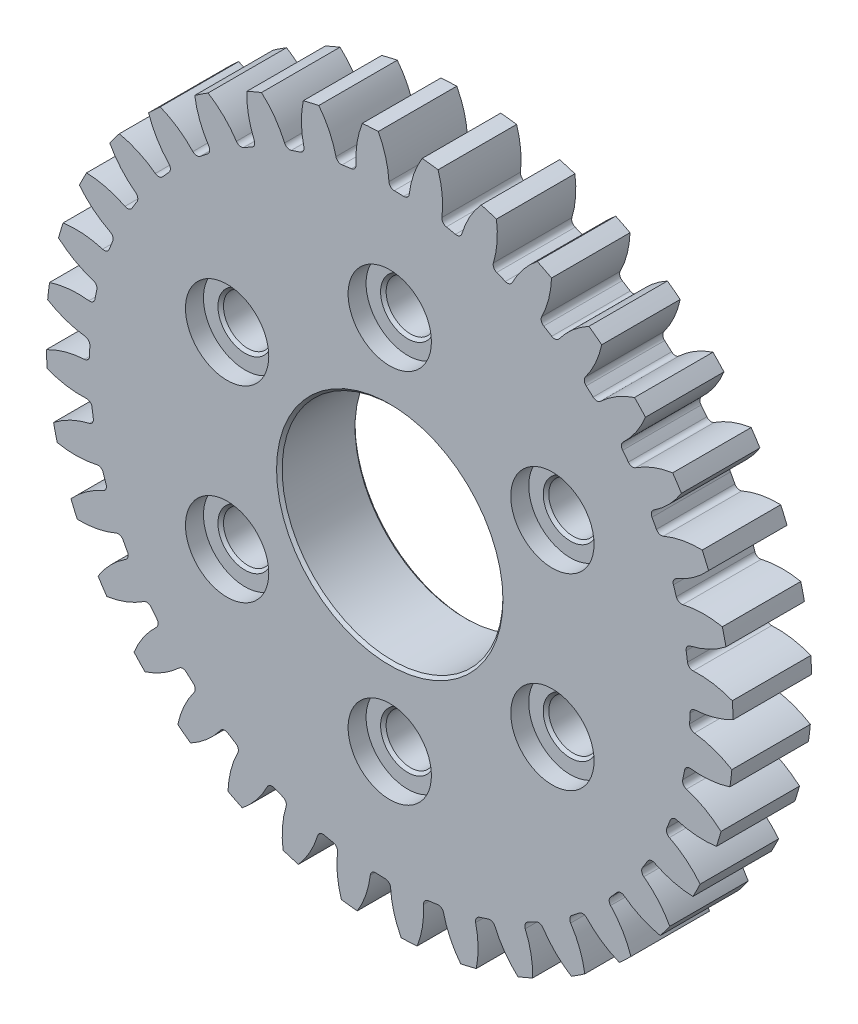
from build123d import *

# Parameters (mm, degrees)
SKETCH1_R                = 24.69999886
SKETCH1_R_2              = 23.39999892
SKETCH1_R_3              = 21.579999004
BOSS_EXTRUDE1_DEPTH      = 2.821
SKETCH8_R                = 7.9375
SKETCH8_R_2              = 1.7526
CUT_EXTRUDE1_DEPTH       = 36.383782321
CUT_EXTRUDE2_DEPTH       = 36.383782321
FILLET3_R                = 0.389999982
CIRPATTERN3_COUNT        = 36
FILLET3_OF_CIRPATTERN3_R = 0.389999982
SKETCH9_R                = 2.994
CUT_EXTRUDE3_DEPTH       = 1.292000064
CHAMFER1_SIZE            = 0.2


with BuildPart() as part:
    # Sketch1 → Boss-Extrude1 (new, symmetric)
    # profile 1 of 3: a face of its own
    with BuildSketch(Plane.XY):
        with Locations(Location((0, 0, 0), (0, 0, 180))):
            Circle(SKETCH1_R)
        Circle(SKETCH1_R_2, mode=Mode.SUBTRACT)
    # profile 2 of 3: a face of its own
    with BuildSketch(Plane.XY):
        Circle(SKETCH1_R_2)
        Circle(SKETCH1_R_3, mode=Mode.SUBTRACT)
    # profile 3 of 3: a face of its own
    with BuildSketch(Plane.XY):
        Circle(SKETCH1_R_3)
    extrude(amount=BOSS_EXTRUDE1_DEPTH, both=True)

    # Sketch8 → Cut-Extrude1 (cut, through all)
    with BuildSketch(Plane.XY.offset(2.821)):
        Circle(SKETCH8_R)
        with Locations((0, 13.5)):
            Circle(SKETCH8_R_2)
        with Locations((11.691342951, 6.75)):
            Circle(SKETCH8_R_2)
        with Locations((11.691342951, -6.75)):
            Circle(SKETCH8_R_2)
        with Locations((0, -13.5)):
            Circle(SKETCH8_R_2)
        with Locations((-11.691342951, -6.75)):
            Circle(SKETCH8_R_2)
        with Locations((-11.691342951, 6.75)):
            Circle(SKETCH8_R_2)
    extrude(amount=-CUT_EXTRUDE1_DEPTH, mode=Mode.SUBTRACT)

    # Sketch5 → Cut-Extrude2 (cut, through all)
    with BuildSketch(Plane(origin=(0, 0, 2.821), x_dir=(0.9995316301484097, -0.0306026197058779, 0), z_dir=(0, 0, 1))):
        with BuildLine():
            ThreePointArc((-2.239902489, 25.602202605), (-1.137864495, 23.712913221), (-0.70785597, 21.568386517))
            ThreePointArc((-0.70785597, 21.568386517), (0, 21.579999004), (0.70785597, 21.568386517))
            ThreePointArc((0.70785597, 21.568386517), (1.137864495, 23.712913221), (2.239902489, 25.602202605))
            ThreePointArc((2.239902489, 25.602202605), (0, 25.69999886), (-2.239902489, 25.602202605))
        make_face()
    cut_extrude2 = extrude(amount=-CUT_EXTRUDE2_DEPTH, mode=Mode.SUBTRACT)

    # Fillet3
    fillet3_edges = [part.edges().sort_by_distance(p)[0] for p in [
        (-0.047475301, 21.579946782, 0),
        (1.367573561, 21.536622288, 0),
    ]]
    fillet(fillet3_edges, radius=FILLET3_R)

    # CirPattern3: Cut-Extrude2 ×36 about axis
    cirpattern3_axis = Axis((0, 0, 0), (0, 0, 1))
    for i in range(1, CIRPATTERN3_COUNT):
        add(cut_extrude2.rotate(cirpattern3_axis, i * 360 / CIRPATTERN3_COUNT), mode=Mode.SUBTRACT)

    # Fillet3 of CirPattern3
    fillet3_of_cirpattern3_edges = [part.edges().sort_by_distance(p)[0] for p in [
        (-3.794072477, 21.243854901, 0),
        (-2.392998167, 21.446909259, 0),
        (-7.425388681, 20.262279239, 0),
        (-6.080859858, 20.705542746, 0),
        (-10.831088208, 18.665044475, 0),
        (-9.583957698, 19.335048794, 0),
        (-13.9076906, 16.50068178, 0),
        (-12.795851834, 17.377069168, 0),
        (-16.56171485, 13.834954219, 0),
        (-15.618950486, 14.891096088, 0),
        (-18.712519776, 10.748858574, 0),
        (-17.967475232, 11.95266459, 0),
        (-20.294754257, 7.336164301, 0),
        (-19.770067335, 8.651057426, 0),
        (-21.2603429, 3.700564388, 0),
        (-20.971955946, 5.086592259, 0),
        (-21.579946782, -0.047475301, 0),
        (-21.536622288, 1.367573561, 0),
        (-21.243854901, -3.794072477, 0),
        (-21.446909259, -2.392998167, 0),
        (-20.262279239, -7.425388681, 0),
        (-20.705542746, -6.080859858, 0),
        (-18.665044475, -10.831088208, 0),
        (-19.335048794, -9.583957698, 0),
        (-16.50068178, -13.9076906, 0),
        (-17.377069168, -12.795851834, 0),
        (-13.834954219, -16.56171485, 0),
        (-14.891096088, -15.618950486, 0),
        (-10.748858574, -18.712519776, 0),
        (-11.95266459, -17.967475232, 0),
        (-7.336164301, -20.294754257, 0),
        (-8.651057426, -19.770067335, 0),
        (-3.700564388, -21.2603429, 0),
        (-5.086592259, -20.971955946, 0),
        (0.047475301, -21.579946782, 0),
        (-1.367573561, -21.536622288, 0),
        (3.794072477, -21.243854901, 0),
        (2.392998167, -21.446909259, 0),
        (7.425388681, -20.262279239, 0),
        (6.080859858, -20.705542746, 0),
        (10.831088208, -18.665044475, 0),
        (9.583957698, -19.335048794, 0),
        (13.9076906, -16.50068178, 0),
        (12.795851834, -17.377069168, 0),
        (16.56171485, -13.834954219, 0),
        (15.618950486, -14.891096088, 0),
        (18.712519776, -10.748858574, 0),
        (17.967475232, -11.95266459, 0),
        (20.294754257, -7.336164301, 0),
        (19.770067335, -8.651057426, 0),
        (21.2603429, -3.700564388, 0),
        (20.971955946, -5.086592259, 0),
        (21.579946782, 0.047475301, 0),
        (21.536622288, -1.367573561, 0),
        (21.243854901, 3.794072477, 0),
        (21.446909259, 2.392998167, 0),
        (20.262279239, 7.425388681, 0),
        (20.705542746, 6.080859858, 0),
        (18.665044475, 10.831088208, 0),
        (19.335048794, 9.583957698, 0),
        (16.50068178, 13.9076906, 0),
        (17.377069168, 12.795851834, 0),
        (13.834954219, 16.56171485, 0),
        (14.891096088, 15.618950486, 0),
        (10.748858574, 18.712519776, 0),
        (11.95266459, 17.967475232, 0),
        (7.336164301, 20.294754257, 0),
        (8.651057426, 19.770067335, 0),
        (3.700564388, 21.2603429, 0),
        (5.086592259, 20.971955946, 0),
    ]]
    fillet(fillet3_of_cirpattern3_edges, radius=FILLET3_OF_CIRPATTERN3_R)

    # Sketch9 → Cut-Extrude3 (cut)
    with BuildSketch(Plane.XY.offset(2.821)):
        with Locations((0, 13.5)):
            Circle(SKETCH9_R)
        with Locations((11.691342951, 6.75)):
            Circle(SKETCH9_R)
        with Locations((11.691342951, -6.75)):
            Circle(SKETCH9_R)
        with Locations((0, -13.5)):
            Circle(SKETCH9_R)
        with Locations((-11.691342951, -6.75)):
            Circle(SKETCH9_R)
        with Locations((-11.691342951, 6.75)):
            Circle(SKETCH9_R)
    extrude(amount=-CUT_EXTRUDE3_DEPTH, mode=Mode.SUBTRACT)

    # Chamfer1
    chamfer1_edges = [part.edges().sort_by_distance(p)[0] for p in [
        (-1.7526, 13.5, 1.528999936),
        (9.938742951, 6.75, 1.528999936),
        (9.938742951, -6.75, 1.528999936),
        (-1.7526, -13.5, 1.528999936),
        (-13.443942951, -6.75, 1.528999936),
        (-13.443942951, 6.75, 1.528999936),
        (-7.9375, 0, -2.821),
        (-7.9375, 0, 2.821),
    ]]
    chamfer(chamfer1_edges, length=CHAMFER1_SIZE)


solid = part.part
